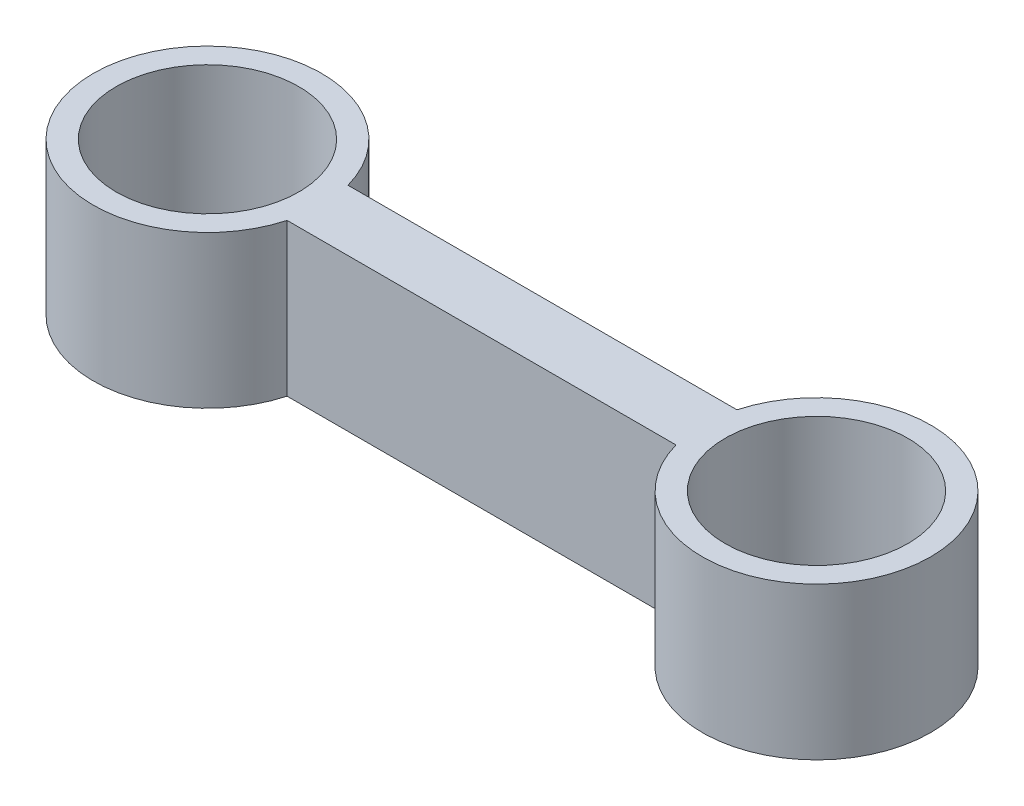
from build123d import *

# Parameters (mm, degrees)
SKETCH_1_R      = 0.75
SKETCH_1_R_2    = 0.6
EXTRUDE_1_DEPTH = 0.5


with BuildPart() as part:
    # 草图1 → 凸台-拉伸1 (new, symmetric)
    # profile 1 of 3: a face of its own
    with BuildSketch(Plane(origin=(0, 0, 0), x_dir=(1, 0, 0), z_dir=(0, 1, 0))):
        with BuildLine():
            Line((1.277158385, 0.2), (-1.277158385, 0.2))
            ThreePointArc((-1.277158385, 0.2), (-1.25682061, 0.100917761), (-1.25, 0))
            ThreePointArc((-1.25, 0), (-1.25682061, -0.100917761), (-1.277158385, -0.2))
            Line((-1.277158385, -0.2), (1.277158385, -0.2))
            ThreePointArc((1.277158385, -0.2), (1.25, 0), (1.277158385, 0.2))
        make_face()
    # profile 2 of 3: a face of its own
    with BuildSketch(Plane(origin=(0, 0, 0), x_dir=(1, 0, 0), z_dir=(0, 1, 0))):
        with Locations((2, 0)):
            Circle(SKETCH_1_R)
        with Locations(Location((2, 0, 0), (0, 0, 270))):
            Circle(SKETCH_1_R_2, mode=Mode.SUBTRACT)
    # profile 3 of 3: a face of its own
    with BuildSketch(Plane(origin=(0, 0, 0), x_dir=(1, 0, 0), z_dir=(0, 1, 0))):
        with Locations((-2, 0)):
            Circle(SKETCH_1_R)
        with Locations(Location((-2, 0, 0), (0, 0, 270))):
            Circle(SKETCH_1_R_2, mode=Mode.SUBTRACT)
    extrude(amount=EXTRUDE_1_DEPTH, both=True)


solid = part.part
